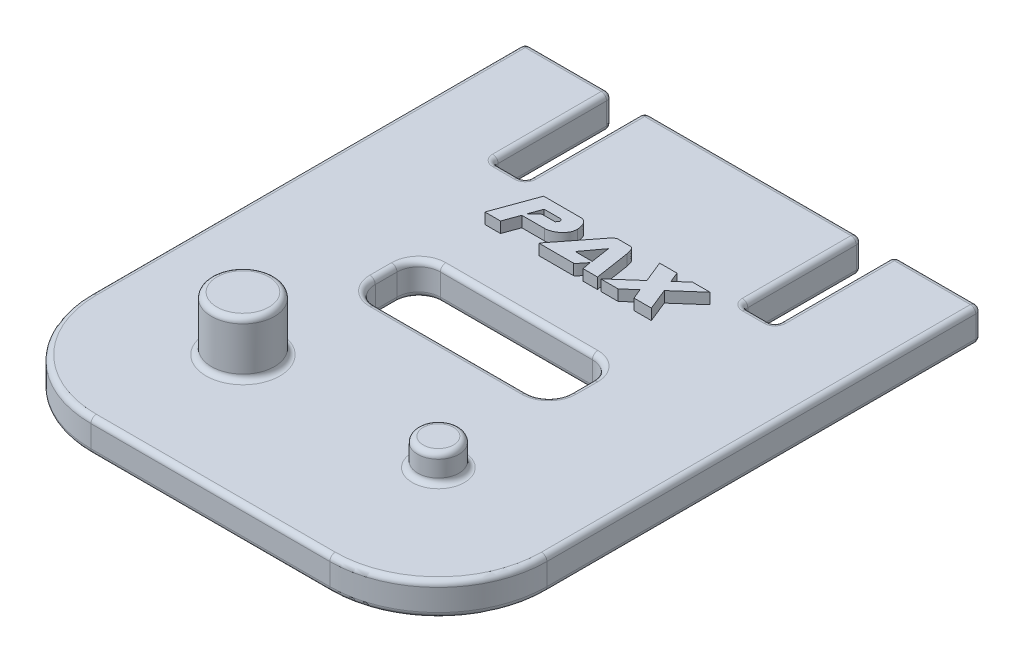
from build123d import *

# Parameters (mm, degrees)
BOSS_EXTRUDE1_DEPTH = 3
FILLET1_R           = 10
SKETCH8_R           = 1.9
BOSS_EXTRUDE4_DEPTH = 2.5
SKETCH9_R           = 2.9
BOSS_EXTRUDE6_DEPTH = 5
BOSS_EXTRUDE7_DEPTH = 1
CUT_EXTRUDE1_DEPTH  = 6
FILLET2_R           = 0.5


with BuildPart() as part:
    # Sketch1 → Boss-Extrude1 (new body)
    with BuildSketch(Plane(origin=(0, 0, 0), x_dir=(1, 0, 0), z_dir=(0, 1, 0))):
        Polygon((-10, -11), (-10, 0), (10, 0), (10, -11), (13, -11), (13, 0), (21, 0), (21, -50), (-21, -50), (-21, 0), (-13, 0), (-13, -11), align=None)
    extrude(amount=BOSS_EXTRUDE1_DEPTH)

    # Fillet1
    fillet1_edges = [part.edges().sort_by_distance(p)[0] for p in [
        (21, 1.5, 50),
        (-21, 1.5, 50),
    ]]
    fillet(fillet1_edges, radius=FILLET1_R)

    # Sketch8 → Boss-Extrude4 (add)
    with BuildSketch(Plane(origin=(0, 3, 0), x_dir=(1, 0, 0), z_dir=(0, 1, 0))):
        with Locations(Location((9, -38, 0), (0, 0, 90))):
            Circle(SKETCH8_R)
    extrude(amount=BOSS_EXTRUDE4_DEPTH)

    # Sketch9 → Boss-Extrude6 (add)
    with BuildSketch(Plane(origin=(0, 3, 0), x_dir=(1, 0, 0), z_dir=(0, 1, 0))):
        with Locations(Location((-9, -38, 0), (0, 0, 90))):
            Circle(SKETCH9_R)
    extrude(amount=BOSS_EXTRUDE6_DEPTH)

    # Sketch10 → Boss-Extrude7 (add)
    # profile 1 of 3: a face of its own
    with BuildSketch(Plane(origin=(0, 3, 0), x_dir=(1, 0, 0), z_dir=(0, 1, 0))):
        with BuildLine():
            Line((-8.241645511, -16.472484073), (-6.803881042, -16.472484073))
            Line((-6.803881042, -16.472484073), (-6.280565113, -15.034719604))
            Line((-6.280565113, -15.034719604), (-4.175383226, -15.034719604))
            add(Edge.make_bspline(
                [(-4.175383226, -15.034719604), (-4.132340256, -15.033414662), (-4.045105424, -15.030769945), (-3.912928568, -15.010481327), (-3.7787982, -14.976214583), (-3.642812605, -14.931049531), (-3.507768332, -14.873965175), (-3.377370234, -14.804918848), (-3.252656265, -14.724770501), (-3.133936508, -14.635298334), (-3.022032271, -14.536228812), (-2.921505515, -14.426378421), (-2.830770428, -14.308295297), (-2.750330285, -14.182616394), (-2.685122927, -14.047908512), (-2.63633003, -13.906379776), (-2.609335389, -13.757249005), (-2.605309955, -13.655924893), (-2.603268498, -13.604539424)],
                knots=[0, 0, 0, 0, 0.88524512, 1.794118975, 2.743742368, 3.730509194, 4.739239437, 5.756226149, 6.761969666, 7.785772429, 8.811837148, 9.831885896, 10.843866812, 11.872403202, 12.895855454, 13.915525334, 14.942880362, 16, 16, 16, 16], degree=3))
            add(Edge.make_bspline(
                [(-2.603268498, -13.604539424), (-2.605298776, -13.550964003), (-2.609649974, -13.436143649), (-2.642660764, -13.259719742), (-2.6922612, -13.077053489), (-2.758804348, -12.931919012), (-2.821405514, -12.822691912), (-2.876854888, -12.748309222), (-2.938465043, -12.680025897), (-3.005727068, -12.618557094), (-3.080872756, -12.565477007), (-3.166878014, -12.530471562), (-3.26049569, -12.507843446), (-3.325802587, -12.505133585), (-3.359530442, -12.503734073)],
                knots=[0, 0, 0, 0, 1.307204634, 2.801540282, 4.369779487, 5.916610494, 6.68321252, 7.439659077, 8.17621895, 8.925230962, 9.661263024, 10.40793656, 11.177776197, 12, 12, 12, 12], degree=3))
            Line((-3.359530442, -12.503734073), (-6.796296754, -12.503734073))
            Line((-6.796296754, -12.503734073), (-8.241645511, -16.472484073))
        make_face()
        with BuildLine():
            Line((-5.733412847, -13.522195717), (-4.198136093, -13.522195717))
            add(Edge.make_bspline(
                [(-4.198136093, -13.522195717), (-4.194828275, -13.523533724), (-4.185273135, -13.527398762), (-4.169891433, -13.539779187), (-4.150110611, -13.560481111), (-4.118577863, -13.594767918), (-4.08170009, -13.636192863), (-4.058428331, -13.67185038), (-4.048617256, -13.686883131)],
                knots=[0, 0, 0, 0, 0.285397342, 0.824413901, 1.562065963, 2.587402001, 4.561292461, 6, 6, 6, 6], degree=3))
            add(Edge.make_bspline(
                [(-4.048617256, -13.686883131), (-4.048229734, -13.687959768), (-4.046472114, -13.692842888), (-4.046231645, -13.702616826), (-4.040384405, -13.713755223), (-4.035673751, -13.720523918), (-4.033448678, -13.723721106)],
                knots=[0, 0, 0, 0, 0.33964349, 1.540464565, 2.838240518, 4, 4, 4, 4], degree=3))
            Line((-4.033448678, -13.723721106), (-4.048617256, -13.76164255))
            add(Edge.make_bspline(
                [(-4.048617256, -13.76164255), (-4.05237918, -13.770777832), (-4.061574175, -13.793106534), (-4.083549433, -13.827700116), (-4.109698279, -13.86874373), (-4.137942379, -13.911297647), (-4.165451736, -13.952956335), (-4.19233584, -13.986400419), (-4.211123847, -14.01214391), (-4.224382274, -14.021083791), (-4.228473248, -14.023842249)],
                knots=[0, 0, 0, 0, 0.740435136, 1.809791362, 3.06562602, 4.396466882, 5.644670785, 6.804997631, 7.631274248, 8, 8, 8, 8], degree=3))
            Line((-4.228473248, -14.023842249), (-5.426790884, -14.023842249))
            Line((-5.426790884, -14.023842249), (-6.145131384, -14.659839042))
            Line((-6.145131384, -14.659839042), (-5.733412847, -13.522195717))
        make_face(mode=Mode.SUBTRACT)
    # profile 2 of 3: a face of its own
    with BuildSketch(Plane(origin=(0, 3, 0), x_dir=(1, 0, 0), z_dir=(0, 1, 0))):
        with BuildLine():
            Line((2.129327734, -16.472484073), (1.63526549, -13.259996017))
            add(Edge.make_bspline(
                [(1.63526549, -13.259996017), (1.627034969, -13.22638908), (1.608948139, -13.152536781), (1.578566144, -13.036050828), (1.543590531, -12.911884161), (1.502199168, -12.790937672), (1.45567456, -12.680059579), (1.405705451, -12.600933963), (1.361291272, -12.550778005), (1.327451176, -12.523424774), (1.290583051, -12.507295028), (1.265216397, -12.504904246), (1.252800639, -12.503734073)],
                knots=[0, 0, 0, 0, 1.16886844, 2.568625121, 4.066902686, 5.525407007, 6.88562871, 8.120874944, 8.66501287, 9.143343883, 9.580708021, 10, 10, 10, 10], degree=3))
            Line((1.252800639, -12.503734073), (-0.005107837, -12.503734073))
            add(Edge.make_bspline(
                [(-0.005107837, -12.503734073), (-0.014600249, -12.504343858), (-0.034876101, -12.505646362), (-0.06583059, -12.518415309), (-0.100700547, -12.535327991), (-0.150921448, -12.569871155), (-0.216093196, -12.620281127), (-0.294407158, -12.686227189), (-0.368942775, -12.758245594), (-0.436718376, -12.829171324), (-0.492669189, -12.892054777), (-0.518723775, -12.934657984), (-0.529507237, -12.952290584)],
                knots=[0, 0, 0, 0, 0.403294416, 0.861439526, 1.412731803, 2.058076458, 3.454194215, 4.930011593, 6.423103676, 7.872623038, 9.119521986, 10, 10, 10, 10], degree=3))
            Line((-0.529507237, -12.952290584), (-3.225180183, -16.397724655))
            Line((-3.225180183, -16.397724655), (-3.225180183, -16.420477521))
            add(Edge.make_bspline(
                [(-3.225180183, -16.420477521), (-3.22555765, -16.420456882), (-3.229047793, -16.420266046), (-3.227097831, -16.434619736), (-3.236070225, -16.447907454), (-3.238750865, -16.463305495), (-3.24034876, -16.472484073)],
                knots=[0, 0, 0, 0, 0.078820996, 0.728795581, 2.050076244, 4, 4, 4, 4], degree=3))
            Line((-3.24034876, -16.472484073), (-0.072282967, -16.472484073))
            add(Edge.make_bspline(
                [(-0.072282967, -16.472484073), (-0.061970915, -16.467008274), (-0.037775837, -16.454160455), (-0.00104893, -16.422794608), (0.043721, -16.381246585), (0.114688904, -16.307907477), (0.208906139, -16.203328275), (0.321298097, -16.069039005), (0.429551488, -15.933736703), (0.512134379, -15.823347574), (0.570091126, -15.743982406), (0.602730439, -15.695837985), (0.624978807, -15.657674097), (0.635335714, -15.63538013), (0.639556713, -15.626294133)],
                knots=[0, 0, 0, 0, 0.376997353, 0.884545572, 1.554567966, 2.356433312, 4.185528084, 6.110402539, 8.023740889, 9.79363745, 10.572330585, 11.204574366, 11.675821058, 12, 12, 12, 12], degree=3))
            Line((0.639556713, -15.626294133), (0.796659839, -16.472484073))
            Line((0.796659839, -16.472484073), (2.129327734, -16.472484073))
        make_face()
        Polygon((-0.880551463, -15.394431589), (0.377357014, -13.708552528), (0.639556713, -15.469191007), (-0.880551463, -15.469191007), align=None, mode=Mode.SUBTRACT)
    # profile 3 of 3: a face of its own
    with BuildSketch(Plane(origin=(0, 3, 0), x_dir=(1, 0, 0), z_dir=(0, 1, 0))):
        Polygon((4.026483413, -16.472484073), (5.104535897, -15.521197559), (5.493501567, -16.472484073), (7.089452632, -16.472484073), (6.287684955, -14.479983049), (8.527217101, -12.503734073), (6.924765217, -12.503734073), (5.860797841, -13.439852009), (5.487000748, -12.503734073), (3.883465395, -12.503734073), (4.685233072, -14.479983049), (2.430532348, -16.472484073), align=None)
    extrude(amount=BOSS_EXTRUDE7_DEPTH)

    # Sketch11 → Cut-Extrude1 (cut)
    with BuildSketch(Plane(origin=(0, 3, 0), x_dir=(1, 0, 0), z_dir=(0, 1, 0))):
        with BuildLine():
            Line((-7, -21.814170355), (7, -21.814170355))
            ThreePointArc((7, -21.814170355), (8.414213562, -22.399956793), (9, -23.814170355))
            Line((9, -23.814170355), (9, -25.814170355))
            ThreePointArc((9, -25.814170355), (8.414213562, -27.228383917), (7, -27.814170355))
            Line((7, -27.814170355), (-7, -27.814170355))
            ThreePointArc((-7, -27.814170355), (-8.414213562, -27.228383917), (-9, -25.814170355))
            Line((-9, -25.814170355), (-9, -23.814170355))
            ThreePointArc((-9, -23.814170355), (-8.414213562, -22.399956793), (-7, -21.814170355))
        make_face()
    extrude(amount=-CUT_EXTRUDE1_DEPTH, mode=Mode.SUBTRACT)

    # Fillet2
    fillet2_edges = [part.edges().sort_by_distance(p)[0] for p in [
        (-17, 3, 0),
        (-10, 0, 5.5),
        (0, 0, 0),
        (10, 0, 5.5),
        (11.5, 0, 11),
        (13, 0, 5.5),
        (17, 0, 0),
        (-21, 3, 20),
        (-21, 0, 20),
        (-17, 0, 0),
        (-13, 0, 5.5),
        (-11.5, 0, 11),
        (0, 0, 27.814170355),
        (8.414213562, 0, 27.228383917),
        (9, 0, 24.814170355),
        (8.414213562, 0, 22.399956793),
        (0, 0, 21.814170355),
        (-8.414213562, 0, 22.399956793),
        (-9, 0, 24.814170355),
        (-8.414213562, 0, 27.228383917),
        (-10, 1.5, 11),
        (-10, 1.5, 0),
        (10, 1.5, 0),
        (10, 1.5, 11),
        (13, 1.5, 11),
        (13, 1.5, 0),
        (21, 1.5, 0),
        (-8.414213562, 3, 27.228383917),
        (0, 3, 27.814170355),
        (8.414213562, 3, 27.228383917),
        (9, 3, 24.814170355),
        (8.414213562, 3, 22.399956793),
        (0, 3, 21.814170355),
        (-8.414213562, 3, 22.399956793),
        (-21, 1.5, 0),
        (-9, 3, 24.814170355),
        (-13, 1.5, 0),
        (-13, 1.5, 11),
        (17, 3, 0),
        (13, 3, 5.5),
        (11.5, 3, 11),
        (10, 3, 5.5),
        (0, 3, 0),
        (-10, 3, 5.5),
        (21, 0, 20),
        (21, 3, 20),
        (0, 0, 50),
        (-18.071067812, 0, 47.071067812),
        (18.071067812, 0, 47.071067812),
        (-11.5, 3, 11),
        (0, 3, 50),
        (-18.071067812, 3, 47.071067812),
        (18.071067812, 3, 47.071067812),
        (9, 3, 39.9),
        (9, 5.5, 39.9),
        (-9, 3, 40.9),
        (-9, 8, 40.9),
        (-13, 3, 5.5),
    ]]
    fillet(fillet2_edges, radius=FILLET2_R)


solid = part.part
